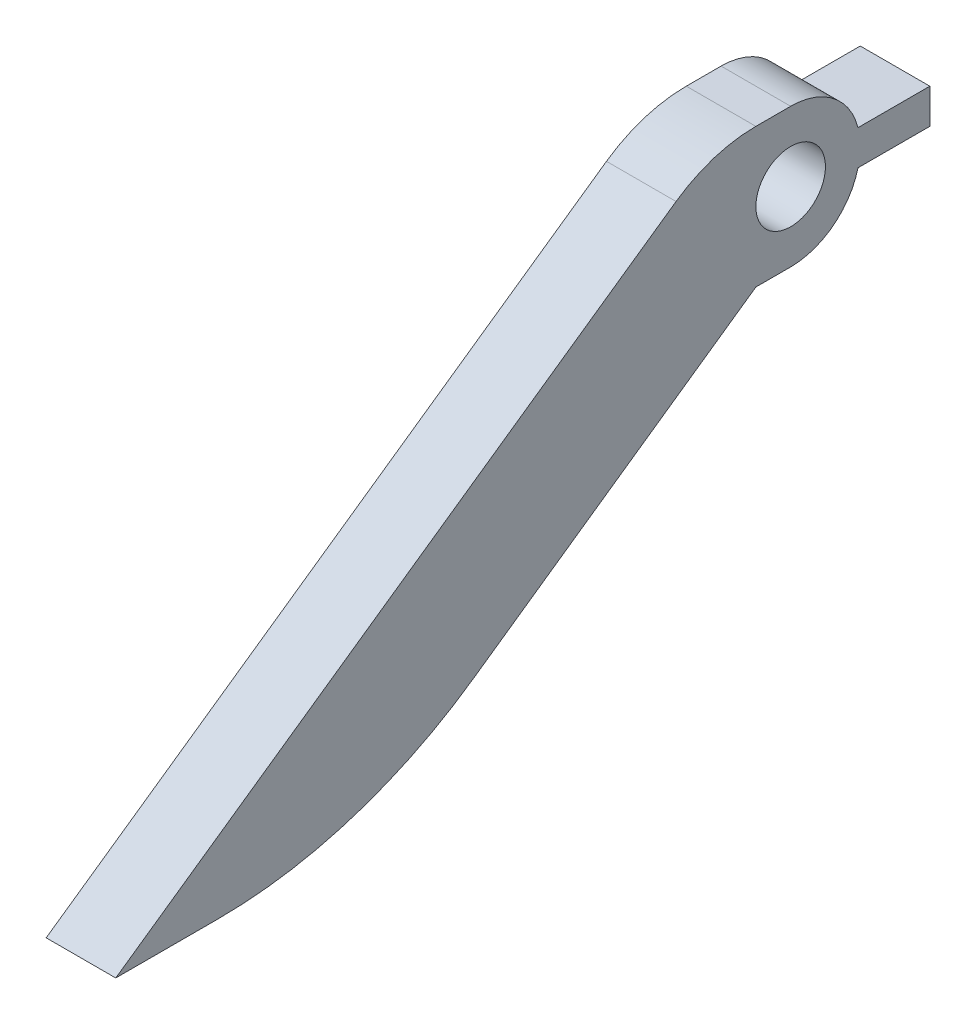
from build123d import *

# Parameters (mm, degrees)
SKETCH2_R           = 3.175
BOSS_EXTRUDE1_DEPTH = 6.35
FILLET1_R           = 40.64


with BuildPart() as part:
    # Sketch2 → Boss-Extrude1 (new body)
    # profile 1 of 2: a face of its own
    with BuildSketch(Plane(origin=(0, 0, 0), x_dir=(0, 0, -1), z_dir=(1, 0, 0))):
        with BuildLine():
            ThreePointArc((40.061425782, 35.803230962), (43.52688287, 37.512205275), (47.345846523, 38.1))
            Line((47.345846523, 38.1), (50.520846523, 38.1))
            ThreePointArc((50.520846523, 38.1), (56.870846523, 31.75), (50.520846523, 25.4))
            Line((50.520846523, 25.4), (47.345846523, 25.4))
            Line((47.345846523, 25.4), (11.070887152, 0))
            Line((11.070887152, 0), (-11.070887152, 0))
            Line((-11.070887152, 0), (40.061425782, 35.803230962))
        make_face()
        with Locations((50.520846523, 31.75)):
            Circle(SKETCH2_R, mode=Mode.SUBTRACT)
    # profile 2 of 2: a face of its own
    with BuildSketch(Plane(origin=(0, 0, 0), x_dir=(0, 0, -1), z_dir=(1, 0, 0))):
        with BuildLine():
            ThreePointArc((56.669207586, 33.3375), (56.870846523, 31.75), (56.669207586, 30.1625))
            Line((56.669207586, 30.1625), (63.220846523, 30.1625))
            Line((63.220846523, 30.1625), (63.220846523, 33.3375))
            Line((63.220846523, 33.3375), (56.669207586, 33.3375))
        make_face()
    extrude(amount=BOSS_EXTRUDE1_DEPTH)

    # Fillet1
    fillet1_edges = [part.edges().sort_by_distance(p)[0] for p in [
        (3.175, 0, -11.070887152),
    ]]
    fillet(fillet1_edges, radius=FILLET1_R)


solid = part.part
